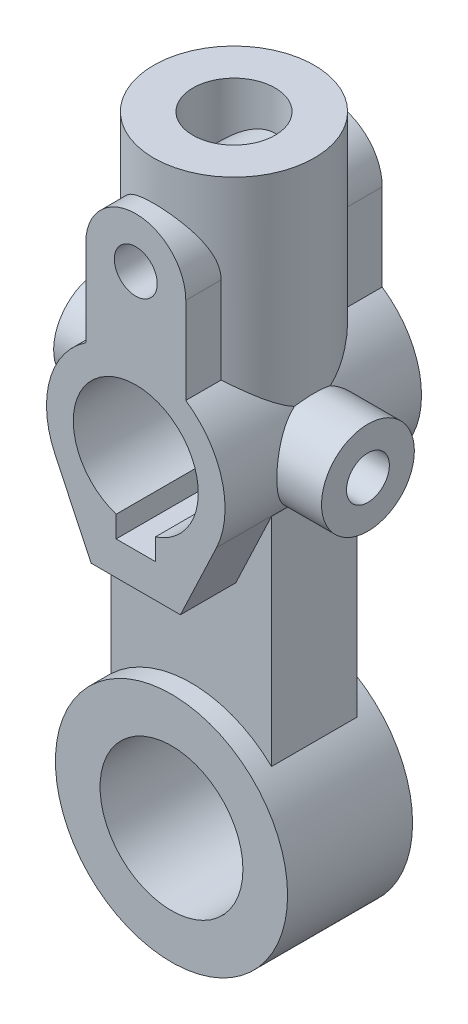
from build123d import *
from build123d.topology import SkipClean

# Parameters (mm, degrees)
CROQUIS1_R              = 32.5
CROQUIS1_R_2            = 20
SALIENTE_EXTRUIR1_DEPTH = 17.5
CROQUIS2_R              = 6
SALIENTE_EXTRUIR2_DEPTH = 27.5
SALIENTE_EXTRUIR3_DEPTH = 12
SALIENTE_EXTRUIR4_REACH = 204.037
CROQUIS4_R              = 22.5
CROQUIS4_R_2            = 11.5
CROQUIS5_R              = 13
CROQUIS5_R_2            = 6
SALIENTE_EXTRUIR5_DEPTH = 37.5
CORTAR_EXTRUIR1_DEPTH   = 178.922033631
CROQUIS7_R              = 6
CORTAR_EXTRUIR2_DEPTH   = 184.320075424


with BuildPart() as part:
    # Croquis1 → Saliente-Extruir1 (new, symmetric)
    with BuildSketch(Plane.XY):
        Circle(CROQUIS1_R)
        Circle(CROQUIS1_R_2, mode=Mode.SUBTRACT)
    extrude(amount=SALIENTE_EXTRUIR1_DEPTH, both=True)



with BuildPart() as body_2:
    # Croquis2 → Saliente-Extruir2 (new, symmetric)
    with BuildSketch(Plane.XY):
        with BuildLine():
            Line((-12.5, 63), (12.5, 63))
            Line((12.5, 63), (22.59139561, 84.29351391))
            ThreePointArc((22.59139561, 84.29351391), (24.114680724, 101.594101422), (14, 115.712315177))
            Line((14, 115.712315177), (14, 140))
            ThreePointArc((14, 140), (0, 154), (-14, 140))
            Line((-14, 140), (-14, 115.712315177))
            ThreePointArc((-14, 115.712315177), (-24.114680724, 101.594101422), (-22.59139561, 84.29351391))
            Line((-22.59139561, 84.29351391), (-12.5, 63))
        make_face()
        with Locations((0, 140)):
            Circle(CROQUIS2_R, mode=Mode.SUBTRACT)
        with BuildLine():
            Line((-5.5, 72.386752274), (5.5, 72.386752274))
            Line((5.5, 72.386752274), (5.5, 78.386752274))
            ThreePointArc((5.5, 78.386752274), (0, 112.5), (-5.5, 78.386752274))
            Line((-5.5, 78.386752274), (-5.5, 72.386752274))
        make_face(mode=Mode.SUBTRACT)
    extrude(amount=SALIENTE_EXTRUIR2_DEPTH, both=True)


with BuildPart() as part_1:
    add(part.part)

    add(body_2.part)  # Saliente-Extruir3 merges body 2
    # Croquis3 → Saliente-Extruir3 (add, symmetric)
    with BuildSketch(Plane.XY):
        with BuildLine():
            Line((-22.5, 84.100663112), (-22.5, 23.452078799))
            ThreePointArc((-22.5, 23.452078799), (0, 32.5), (22.5, 23.452078799))
            Line((22.5, 23.452078799), (22.5, 84.100663112))
            Line((22.5, 84.100663112), (12.5, 63))
            Line((12.5, 63), (-12.5, 63))
            Line((-12.5, 63), (-22.5, 84.100663112))
        make_face()
    extrude(amount=SALIENTE_EXTRUIR3_DEPTH, both=True)

    # Croquis4 → Saliente-Extruir4 (add, up to next)
    with BuildSketch(Plane(origin=(0, 165, 0), x_dir=(1, 0, 0), z_dir=(0, 1, 0)), mode=Mode.PRIVATE) as saliente_extruir4_sk1:
        with Locations(Location((0, 0, 0), (0, 0, 270))):
            Circle(CROQUIS4_R)
        with Locations(Location((0, 0, 0), (0, 0, 270))):
            Circle(CROQUIS4_R_2, mode=Mode.SUBTRACT)
    saliente_extruir4_tool1 = extrude(saliente_extruir4_sk1.sketch, amount=-SALIENTE_EXTRUIR4_REACH, mode=Mode.PRIVATE) - part_1.part
    add(saliente_extruir4_tool1.solids().sort_by_distance((0, 165, -21.863604))[0])

    # Croquis5 → Saliente-Extruir5 (add, symmetric)
    with BuildSketch(Plane(origin=(0, 0, 0), x_dir=(0, 0, -1), z_dir=(1, 0, 0))):
        with Locations(Location((0, 95, 0), (0, 0, 235.444369164))):
            Circle(CROQUIS5_R)
        with Locations(Location((0, 95, 0), (0, 0, 180))):
            Circle(CROQUIS5_R_2, mode=Mode.SUBTRACT)
    extrude(amount=SALIENTE_EXTRUIR5_DEPTH, both=True)

    # Croquis6 → Cortar-Extruir1 (cut, through all)
    with BuildSketch(Plane.XY.offset(27.5)):
        with BuildLine():
            Line((5.5, 72.386752274), (5.5, 78.386752274))
            ThreePointArc((5.5, 78.386752274), (0, 112.5), (-5.5, 78.386752274))
            Line((-5.5, 78.386752274), (-5.5, 72.386752274))
            Line((-5.5, 72.386752274), (5.5, 72.386752274))
        make_face()
    extrude(amount=-CORTAR_EXTRUIR1_DEPTH, mode=Mode.SUBTRACT)

    # Croquis7 → Cortar-Extruir2 (cut, through all)
    with SkipClean():  # the faces are left unmerged after this step: merging them gives an invalid solid
        with BuildSketch(Plane(origin=(37.5, 0, 0), x_dir=(0, 0, -1), z_dir=(1, 0, 0))):
            with Locations((0, 95)):
                Circle(CROQUIS7_R)
        extrude(amount=-CORTAR_EXTRUIR2_DEPTH, mode=Mode.SUBTRACT)


solid = part_1.part
